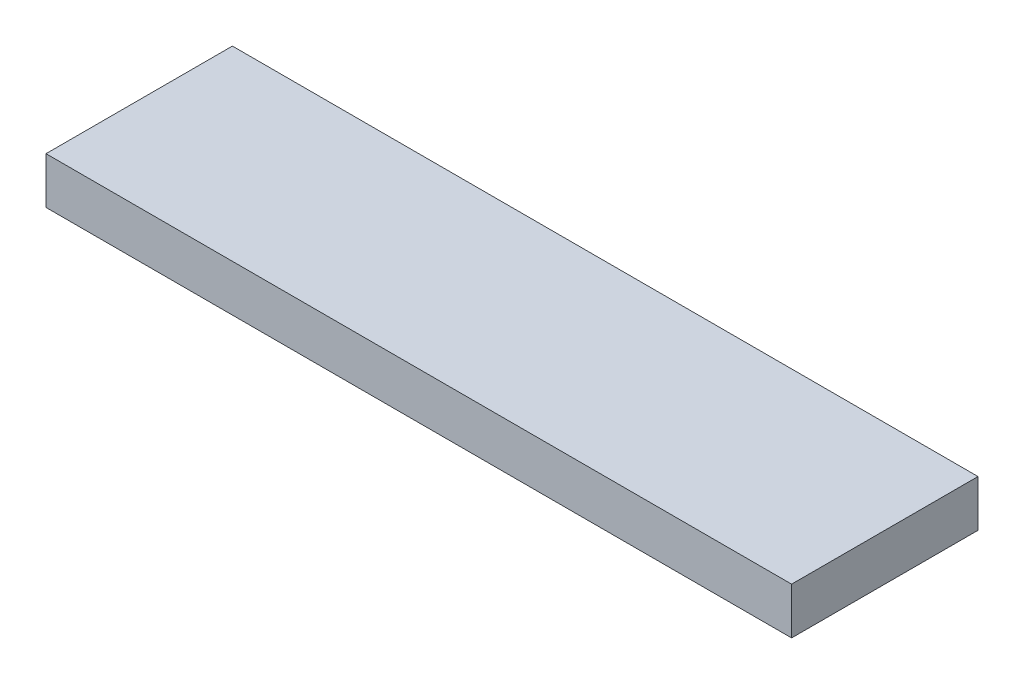
from build123d import *

# Parameters (mm, degrees)
SKETCH1_W           = 203.2
SKETCH1_H           = 50.8
BOSS_EXTRUDE1_DEPTH = 12.7


with BuildPart() as part:
    # Sketch1 → Boss-Extrude1 (new body)
    with BuildSketch(Plane(origin=(0, 0, 0), x_dir=(1, 0, 0), z_dir=(0, 1, 0))):
        Rectangle(SKETCH1_W, SKETCH1_H)
    extrude(amount=BOSS_EXTRUDE1_DEPTH)


solid = part.part
